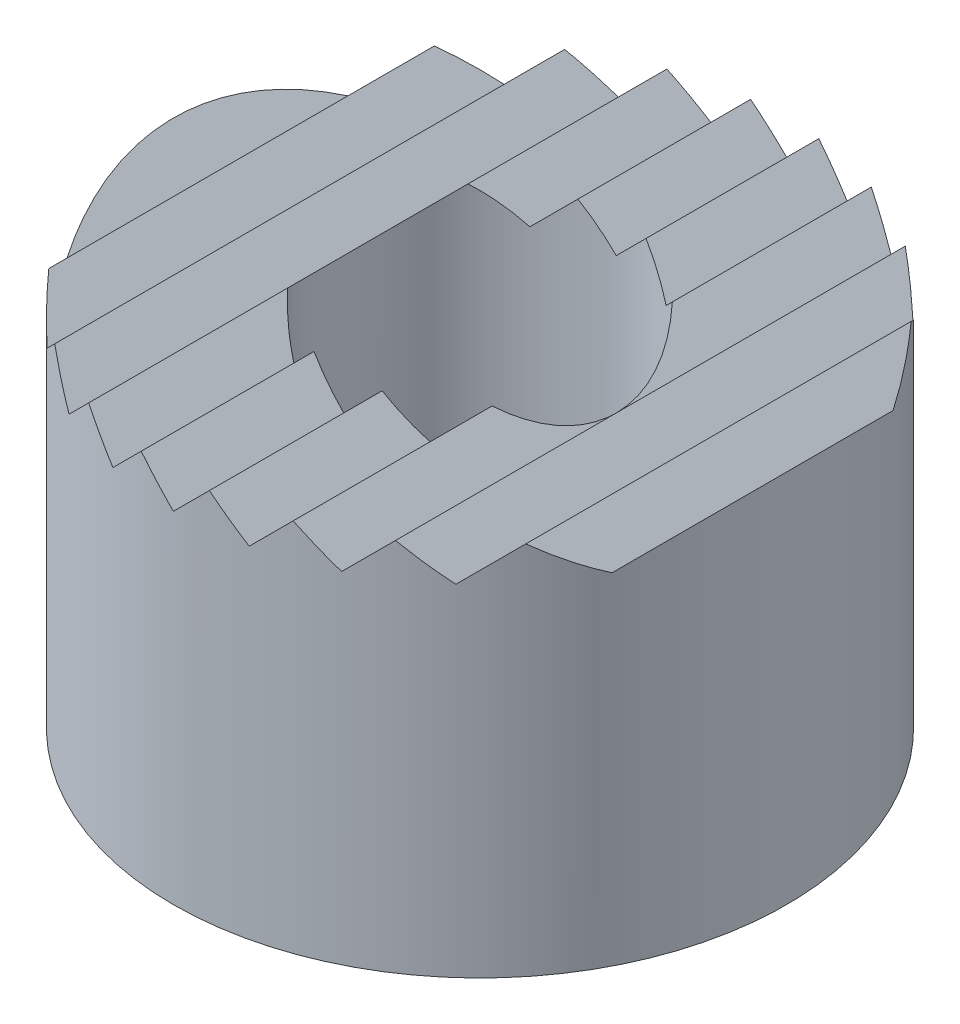
from build123d import *

# Parameters (mm, degrees)
SKETCH_1_R               = 3.6
SKETCH_1_R_2             = 1.6
EXTRUDE_1_DEPTH          = 4.4
CUT_EXTRUDE_1_DEPTH      = 10
CUT_EXTRUDE_1_DEPTH_BACK = 10


with BuildPart() as part:
    # 草图1 → 凸台-拉伸1 (new body)
    with BuildSketch(Plane(origin=(0, 0, 0), x_dir=(1, 0, 0), z_dir=(0, 1, 0))):
        Circle(SKETCH_1_R)
        Circle(SKETCH_1_R_2, mode=Mode.SUBTRACT)
    extrude(amount=EXTRUDE_1_DEPTH)

    # 草图2 → 切除-拉伸1 (cut, two sides: drawn at the far end of the back side and taken through both)
    with BuildSketch(Plane.XY.offset(-CUT_EXTRUDE_1_DEPTH_BACK)):
        Polygon((-2.8, 4.4), (-3.6, 4.4), (-3.2, 4), align=None)
        Polygon((3.6, 4.4), (2.8, 4.4), (3.2, 4), align=None)
        Polygon((2.8, 4.4), (2, 4.4), (2.4, 4), align=None)
        Polygon((2, 4.4), (1.2, 4.4), (1.6, 4), align=None)
        Polygon((1.2, 4.4), (0.4, 4.4), (0.8, 4), align=None)
        Polygon((0.4, 4.4), (-0.4, 4.4), (0, 4), align=None)
        Polygon((-0.4, 4.4), (-1.2, 4.4), (-0.8, 4), align=None)
        Polygon((-1.2, 4.4), (-2, 4.4), (-1.6, 4), align=None)
        Polygon((-2, 4.4), (-2.8, 4.4), (-2.4, 4), align=None)
    extrude(amount=CUT_EXTRUDE_1_DEPTH + CUT_EXTRUDE_1_DEPTH_BACK, mode=Mode.SUBTRACT)


solid = part.part
